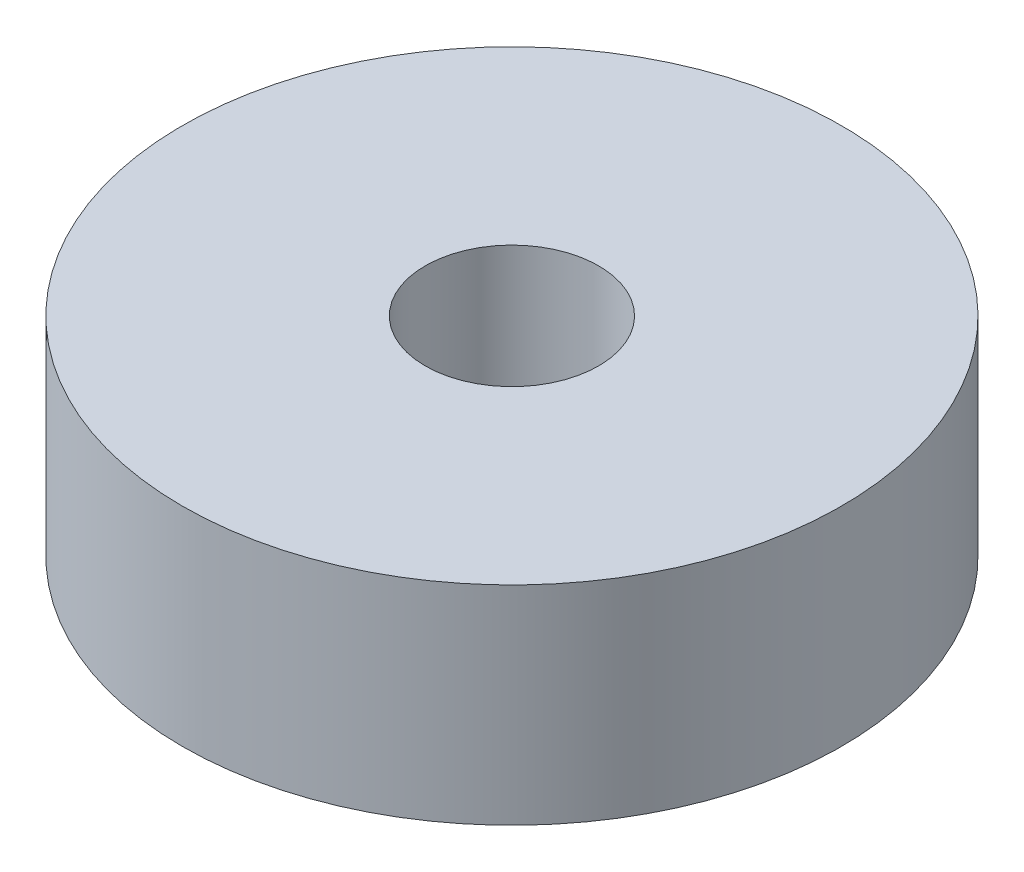
from build123d import *

# Parameters (mm, degrees)
SZKIC1_R                    = 9.5
SZKIC1_R_2                  = 2.5
DODANIE_WYCI_GNI_CIE1_DEPTH = 6


with BuildPart() as part:
    # Szkic1 → Dodanie-wyciągnięcie1 (new body)
    with BuildSketch(Plane(origin=(0, 0, 0), x_dir=(1, 0, 0), z_dir=(0, 1, 0))):
        with Locations(Location((230.603132321, -212.537436794, 0), (0, 0, 270))):
            Circle(SZKIC1_R)
        with Locations(Location((230.603132321, -212.537436794, 0), (0, 0, 270))):
            Circle(SZKIC1_R_2, mode=Mode.SUBTRACT)
    extrude(amount=DODANIE_WYCI_GNI_CIE1_DEPTH)


solid = part.part
